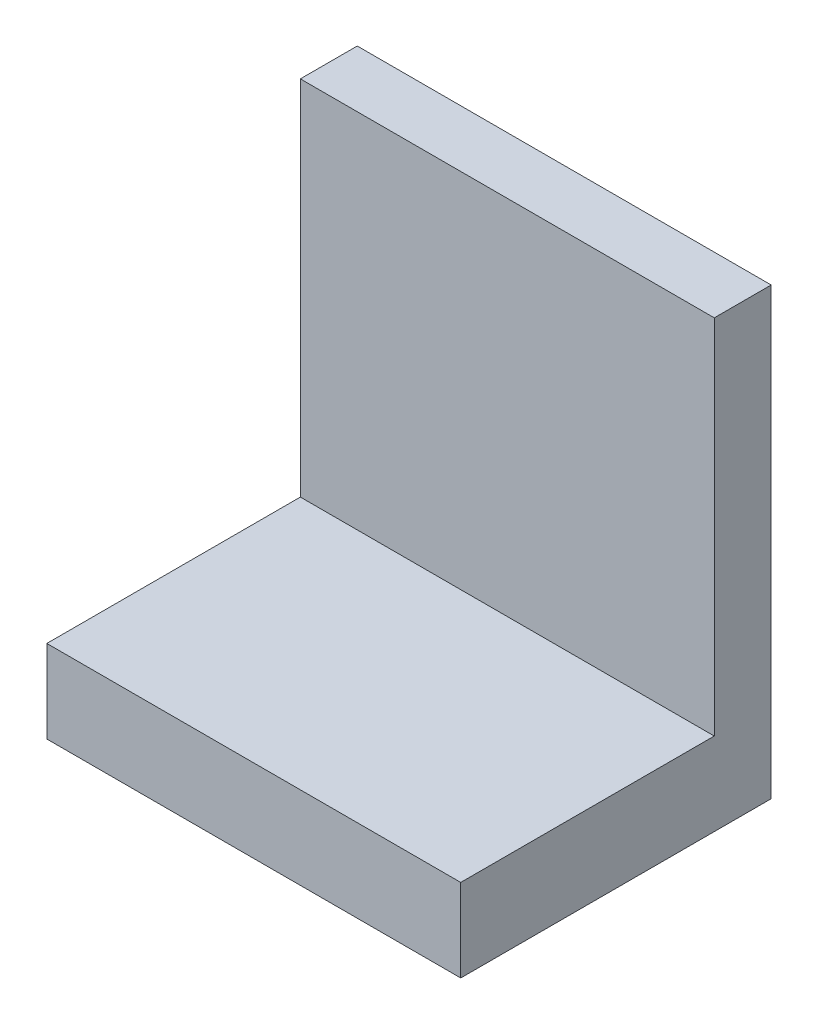
from build123d import *

# Parameters (mm, degrees)
SKETCH1_W           = 8
SKETCH1_H           = 6
BOSS_EXTRUDE1_DEPTH = 1.6
SKETCH2_W           = 8
SKETCH2_H           = 1.1
BOSS_EXTRUDE2_DEPTH = 7


with BuildPart() as part:
    # Sketch1 → Boss-Extrude1 (new body)
    with BuildSketch(Plane(origin=(0, 0, 0), x_dir=(1, 0, 0), z_dir=(0, 1, 0))):
        Rectangle(SKETCH1_W, SKETCH1_H)
    extrude(amount=BOSS_EXTRUDE1_DEPTH)

    # Sketch2 → Boss-Extrude2 (add)
    with BuildSketch(Plane(origin=(0, 1.6, 0), x_dir=(1, 0, 0), z_dir=(0, 1, 0))):
        with Locations((0, 2.45)):
            Rectangle(SKETCH2_W, SKETCH2_H)
    extrude(amount=BOSS_EXTRUDE2_DEPTH)


solid = part.part
